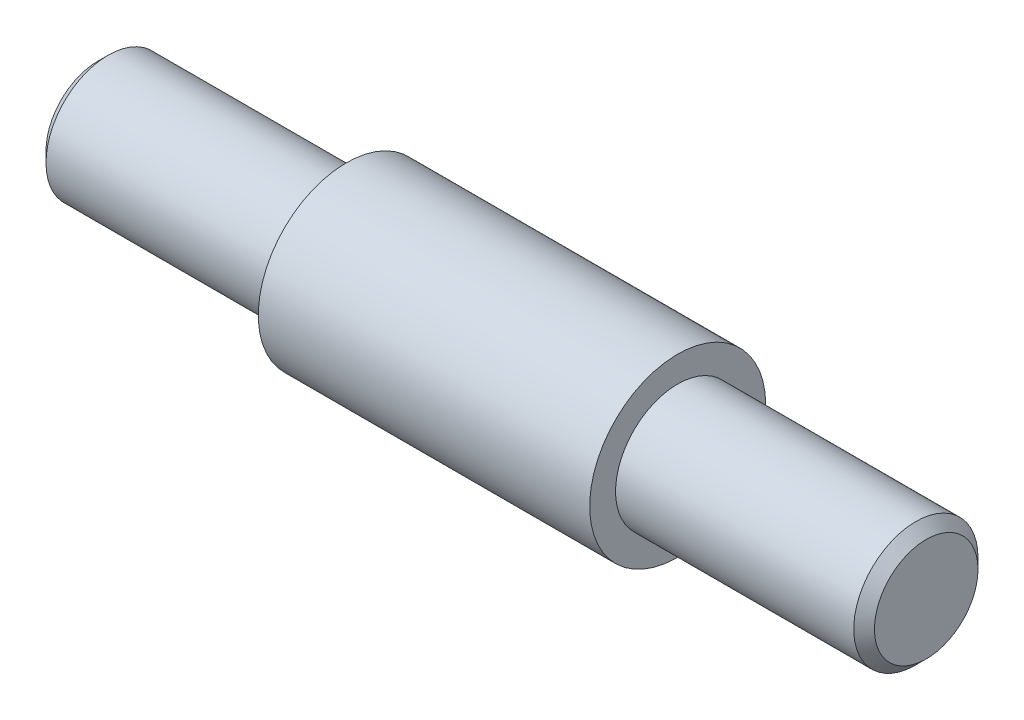
from build123d import *

# Parameters (mm, degrees)
CHAMFER1_SIZE = 0.5


with BuildPart() as part:
    # Sketch1 → Revolve1 (revolve)
    with BuildSketch(Plane.XY, mode=Mode.PRIVATE) as revolve1_sk:
        Polygon((0, 0), (-20, 0), (-20, 3), (-8, 3), (-8, 4.25), (8, 4.25), (8, 3), (20, 3), (20, 0), align=None)
    revolve(revolve1_sk.sketch.rotate(Axis((0, 0, 0), (-1, 0, 0)), 90), axis=Axis((0, 0, 0), (-1, 0, 0)))

    # Chamfer1
    chamfer1_edges = [part.edges().sort_by_distance(p)[0] for p in [
        (20, 0, 3),
        (-20, 0, 3),
    ]]
    chamfer(chamfer1_edges, length=CHAMFER1_SIZE)


solid = part.part
